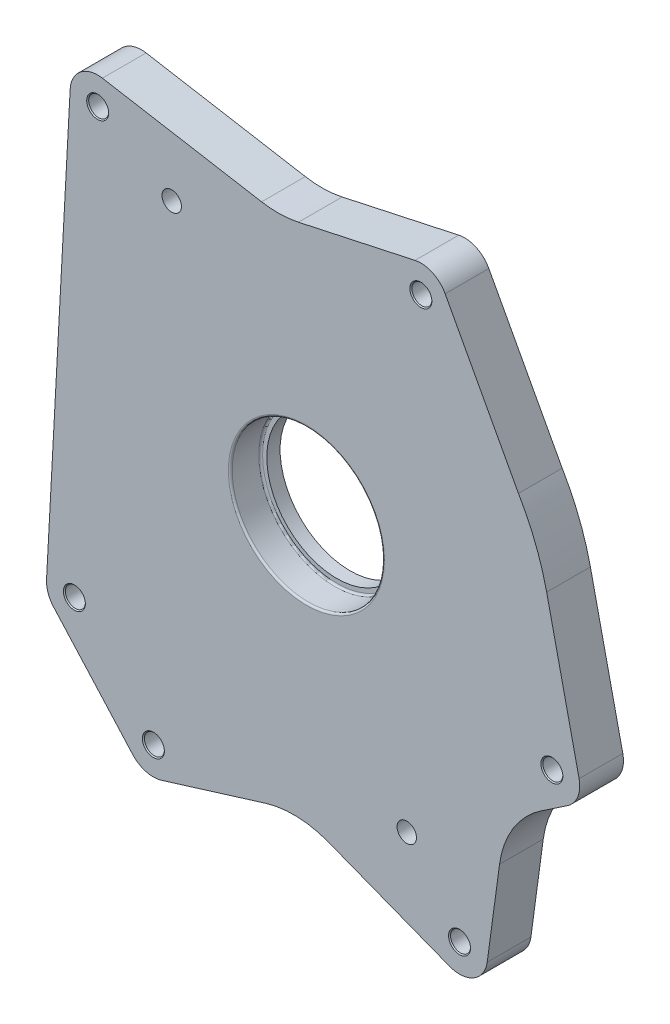
from build123d import *

# Parameters (mm, degrees)
SKETCH1_R                       = 1.5
SKETCH1_R_2                     = 5.100618704
BOSS_EXTRUDE1_DEPTH             = 23
FILLET2_R                       = 50.8
SKETCH2_R                       = 40.05
CUT_EXTRUDE1_DEPTH              = 16
SKETCH5_R                       = 36.83
CUT_EXTRUDE2_DEPTH              = 25.4
FILLET5_R                       = 1
FILLET6_R                       = 1
M10_CLEARANCE_HOLE4_D           = 10.5
M10_CLEARANCE_HOLE4_CSINK_D     = 11.55
M10_CLEARANCE_HOLE4_CSINK_ANGLE = 90


with BuildPart() as part:
    # Sketch1 → Boss-Extrude1 (new body)
    with BuildSketch(Plane.XY):
        with BuildLine():
            Line((75.260281277, -167.806485638), (-4.700564051, -136.778396463))
            Line((-4.700564051, -136.778396463), (-76.156211748, -158.845068243))
            ThreePointArc((-76.156211748, -158.845068243), (-84.397046653, -158.966738807), (-91.402736844, -154.625486844))
            Line((-91.402736844, -154.625486844), (-132.961820606, -108.305285312))
            ThreePointArc((-132.961820606, -108.305285312), (-135.879409932, -103.381593327), (-136.690789762, -97.716195457))
            Line((-136.690789762, -97.716195457), (-124.255747511, 131.9473438))
            ThreePointArc((-124.255747511, 131.9473438), (-118.813814635, 142.502935513), (-107.309980144, 145.451993305))
            Line((-107.309980144, 145.451993305), (-13.820265411, 129.310675557))
            Line((-13.820265411, 129.310675557), (57.154321142, 144.67282316))
            ThreePointArc((57.154321142, 144.67282316), (66.292090414, 143.669172059), (72.989999045, 137.372810987))
            Line((72.989999045, 137.372810987), (111.561324809, 65.705034096))
            ThreePointArc((111.561324809, 65.705034096), (120.450704592, 47.507478462), (126.394675624, 28.146659461))
            Line((126.394675624, 28.146659461), (143.447960396, -48.284765241))
            ThreePointArc((143.447960396, -48.284765241), (142.753389973, -56.92050988), (137.306991007, -63.658109738))
            Line((137.306991007, -63.658109738), (104.679233021, -85.560920301))
            Line((104.679233021, -85.560920301), (95.102188007, -156.104602115))
            ThreePointArc((95.102188007, -156.104602115), (88.018421694, -166.766325043), (75.260281277, -167.806485638))
        make_face()
        with Locations((-109.776955272, 131.163395273)):
            Circle(SKETCH1_R, mode=Mode.SUBTRACT)
        with Locations((-70.826725389, 107.740981135)):
            Circle(SKETCH1_R_2, mode=Mode.SUBTRACT)
        with Locations((-122.043542394, -98.509264921)):
            Circle(SKETCH1_R, mode=Mode.SUBTRACT)
        with Locations((-80.484458632, -144.829466453)):
            Circle(SKETCH1_R, mode=Mode.SUBTRACT)
        with Locations((52.801836898, -118.009411705)):
            Circle(SKETCH1_R_2, mode=Mode.SUBTRACT)
        with Locations((80.566824551, -154.131274008)):
            Circle(SKETCH1_R, mode=Mode.SUBTRACT)
        with Locations((129.131286757, -51.479083724)):
            Circle(SKETCH1_R, mode=Mode.SUBTRACT)
        with Locations((60.221754192, 130.500990023)):
            Circle(SKETCH1_R, mode=Mode.SUBTRACT)
    extrude(amount=BOSS_EXTRUDE1_DEPTH)

    # Fillet2
    fillet2_edges = [part.edges().sort_by_distance(p)[0] for p in [
        (104.679233021, -85.560920301, 11.5),
        (-4.700564051, -136.778396463, 11.5),
        (-13.820265411, 129.310675557, 11.5),
    ]]
    fillet(fillet2_edges, radius=FILLET2_R)

    # Sketch2 → Cut-Extrude1 (cut)
    with BuildSketch(Plane(origin=(0, 0, 23), x_dir=(-1, 0, 0), z_dir=(0, 0, -1))):
        Circle(SKETCH2_R)
    extrude(amount=CUT_EXTRUDE1_DEPTH, mode=Mode.SUBTRACT)

    # Sketch5 → Cut-Extrude2 (cut)
    with BuildSketch(Plane(origin=(0, 0, 23), x_dir=(-1, 0, 0), z_dir=(0, 0, -1))):
        with Locations(Location((0, 0, 0), (0, 0, 180))):
            Circle(SKETCH5_R)
    extrude(amount=CUT_EXTRUDE2_DEPTH, mode=Mode.SUBTRACT)

    # Fillet5
    fillet5_edges = [part.edges().sort_by_distance(p)[0] for p in [
        (40.05, 0, 23),
    ]]
    fillet(fillet5_edges, radius=FILLET5_R)

    # Fillet6
    fillet6_edges = [part.edges().sort_by_distance(p)[0] for p in [
        (40.05, 0, 7),
    ]]
    fillet(fillet6_edges, radius=FILLET6_R)

    # M10 Clearance Hole4 (through all)
    with Locations(Plane.XY.offset(23)):
        with Locations((60.221754192, 130.500990023), (-109.776955272, 131.163395273), (129.131286757, -51.479083724), (80.566824551, -154.131274008), (-80.484458632, -144.829466453), (-122.043542394, -98.509264921)):
            CounterSinkHole(M10_CLEARANCE_HOLE4_D / 2, M10_CLEARANCE_HOLE4_CSINK_D / 2, counter_sink_angle=M10_CLEARANCE_HOLE4_CSINK_ANGLE)


solid = part.part
